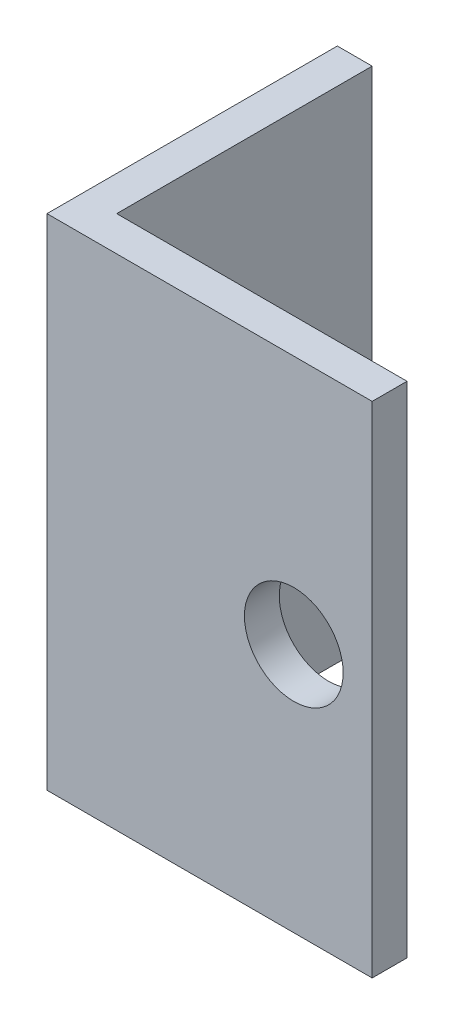
from build123d import *

# Parameters (mm, degrees)
CROQUIS1_W              = 25
CROQUIS1_H              = 3
SALIENTE_EXTRUIR1_DEPTH = 195
CROQUIS2_R              = 4.25
CORTAR_EXTRUIR1_DEPTH   = 195
CROQUIS3_W              = 4
CROQUIS3_H              = 25
SALIENTE_EXTRUIR2_DEPTH = 195
SALIENTE_EXTRUIR3_START = 1
CROQUIS4_W              = 29
CROQUIS4_H              = 195
CROQUIS4_R              = 4.25
SALIENTE_EXTRUIR3_DEPTH = 1
CROQUIS5_W              = 149.811438776
CROQUIS5_H              = 152
CORTAR_EXTRUIR4_DEPTH   = 40
CROQUIS6_R              = 4.25
CORTAR_EXTRUIR5_DEPTH   = 40
SALIENTE_EXTRUIR4_DEPTH = 4
CROQUIS8_W              = 1
CROQUIS8_H              = 26
CORTAR_EXTRUIR6_DEPTH   = 60
CROQUIS9_W              = 28
CROQUIS9_H              = 1
CORTAR_EXTRUIR7_DEPTH   = 60


with BuildPart() as part:
    # Croquis1 → Saliente-Extruir1 (new body)
    with BuildSketch(Plane(origin=(0, 0, 0), x_dir=(1, 0, 0), z_dir=(0, 1, 0))):
        with Locations((12.5, -1.5)):
            Rectangle(CROQUIS1_W, CROQUIS1_H)
    extrude(amount=SALIENTE_EXTRUIR1_DEPTH)

    # Croquis2 → Cortar-Extruir1 (cut)
    with BuildSketch(Plane.XY.offset(3)):
        with Locations((18.25, 180)):
            Circle(CROQUIS2_R)
        with Locations((18.25, 97.5)):
            Circle(CROQUIS2_R)
        with Locations((18.25, 15)):
            Circle(CROQUIS2_R)
    extrude(amount=-CORTAR_EXTRUIR1_DEPTH, mode=Mode.SUBTRACT)

    # Croquis3 → Saliente-Extruir2 (add)
    with BuildSketch(Plane(origin=(0, 195, 0), x_dir=(1, 0, 0), z_dir=(0, 1, 0))):
        with Locations((-2, 9.5)):
            Rectangle(CROQUIS3_W, CROQUIS3_H)
    extrude(amount=-SALIENTE_EXTRUIR2_DEPTH)

    # Croquis4 → Saliente-Extruir3 (add)
    with BuildSketch(Plane.XY.offset(3).offset(SALIENTE_EXTRUIR3_START)):
        with Locations((10.5, 97.5)):
            Rectangle(CROQUIS4_W, CROQUIS4_H)
        with Locations((18.25, 15)):
            Circle(CROQUIS4_R, mode=Mode.SUBTRACT)
        with Locations((18.25, 97.5)):
            Circle(CROQUIS4_R, mode=Mode.SUBTRACT)
        with Locations((18.25, 180)):
            Circle(CROQUIS4_R, mode=Mode.SUBTRACT)
    extrude(amount=-SALIENTE_EXTRUIR3_DEPTH)

    # Croquis5 → Cortar-Extruir4 (cut)
    with BuildSketch(Plane.XY.offset(4)):
        with Locations((-49.905719388, 76)):
            Rectangle(CROQUIS5_W, CROQUIS5_H)
    extrude(amount=-CORTAR_EXTRUIR4_DEPTH, mode=Mode.SUBTRACT)

    # Croquis6 → Cortar-Extruir5 (cut)
    with BuildSketch(Plane.XY.offset(4)):
        with Locations((18.25, 173.5)):
            Circle(CROQUIS6_R)
    extrude(amount=-CORTAR_EXTRUIR5_DEPTH, mode=Mode.SUBTRACT)

    # Croquis7 → Saliente-Extruir4 (add)
    with BuildSketch(Plane.XY.offset(4)):
        with BuildLine():
            ThreePointArc((20.988612788, 176.75), (22.103673854, 178.207878959), (22.5, 180))
            ThreePointArc((22.5, 180), (16.457878959, 183.853673854), (15.511387212, 176.75))
            ThreePointArc((15.511387212, 176.75), (18.25, 177.75), (20.988612788, 176.75))
        make_face()
    extrude(amount=-SALIENTE_EXTRUIR4_DEPTH)

    # Croquis8 → Cortar-Extruir6 (cut)
    with BuildSketch(Plane(origin=(0, 195, 0), x_dir=(1, 0, 0), z_dir=(0, 1, 0))):
        with Locations((-3.5, 9)):
            Rectangle(CROQUIS8_W, CROQUIS8_H)
    extrude(amount=-CORTAR_EXTRUIR6_DEPTH, mode=Mode.SUBTRACT)

    # Croquis9 → Cortar-Extruir7 (cut)
    with BuildSketch(Plane(origin=(0, 195, 0), x_dir=(1, 0, 0), z_dir=(0, 1, 0))):
        with Locations((11, -3.5)):
            Rectangle(CROQUIS9_W, CROQUIS9_H)
    extrude(amount=-CORTAR_EXTRUIR7_DEPTH, mode=Mode.SUBTRACT)


solid = part.part
